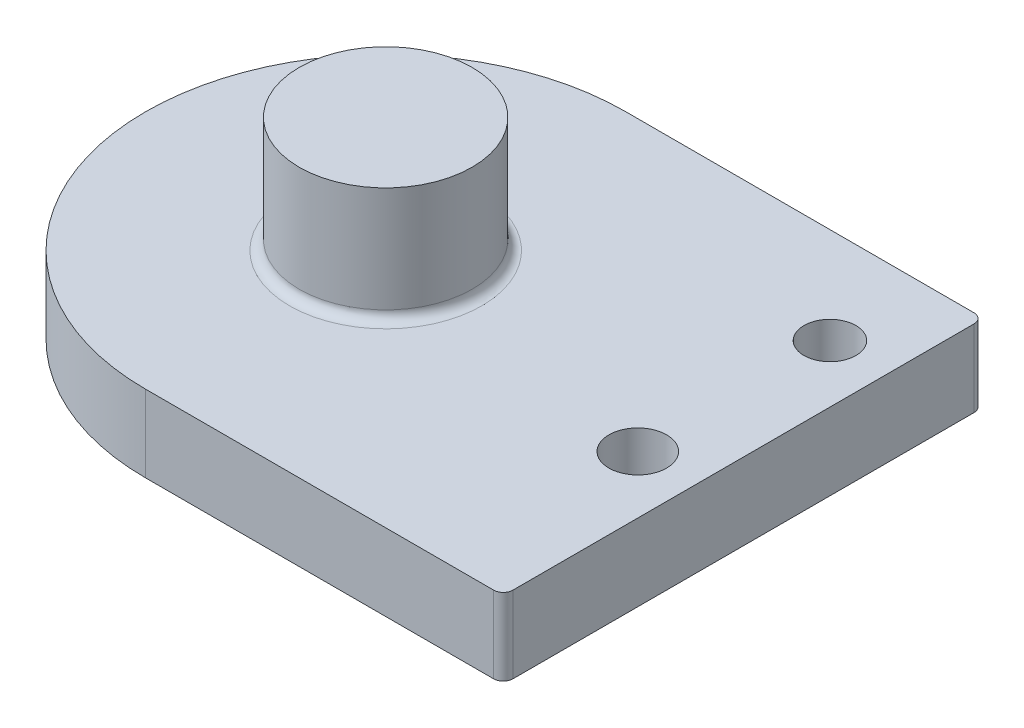
from build123d import *

# Parameters (mm, degrees)
EXTRUDE_1_DEPTH     = 2
SKETCH_2_R          = 2.25
EXTRUDE_2_DEPTH     = 3
SKETCH_3_R          = 0.676633681
SKETCH_3_R_2        = 0.750657672
CUT_EXTRUDE_1_DEPTH = 10
FILLET_1_R          = 0.25
FILLET_2_R          = 0.25


with BuildPart() as part:
    # 草图1 → 凸台-拉伸1 (new body)
    with BuildSketch(Plane(origin=(0, 0, 0), x_dir=(1, 0, 0), z_dir=(0, 1, 0))):
        with BuildLine():
            Line((5, 0), (14.310335592, 0))
            Line((14.310335592, 0), (14.310335592, 12.5))
            Line((14.310335592, 12.5), (5, 12.5))
            ThreePointArc((5, 12.5), (-1.25, 6.25), (5, 0))
        make_face()
    extrude(amount=EXTRUDE_1_DEPTH)

    # 草图2 → 凸台-拉伸2 (add)
    with BuildSketch(Plane(origin=(0, 2, 0), x_dir=(1, 0, 0), z_dir=(0, 1, 0))):
        with Locations(Location((5, 6.25, 0), (0, 0, 270))):
            Circle(SKETCH_2_R)
    extrude(amount=EXTRUDE_2_DEPTH)

    # 草图3 → 切除-拉伸1 (cut)
    with BuildSketch(Plane(origin=(0, 2, 0), x_dir=(1, 0, 0), z_dir=(0, 1, 0))):
        with Locations(Location((12.810335592, 10, 0), (0, 0, 270))):
            Circle(SKETCH_3_R)
        with Locations(Location((12.810335592, 5, 0), (0, 0, 270))):
            Circle(SKETCH_3_R_2)
    extrude(amount=-CUT_EXTRUDE_1_DEPTH, mode=Mode.SUBTRACT)

    # 圆角1
    fillet_1_edges = [part.edges().sort_by_distance(p)[0] for p in [
        (5, 2, -8.5),
    ]]
    fillet(fillet_1_edges, radius=FILLET_1_R)

    # 圆角2
    fillet_2_edges = [part.edges().sort_by_distance(p)[0] for p in [
        (14.310335592, 1, 0),
        (14.310335592, 1, -12.5),
    ]]
    fillet(fillet_2_edges, radius=FILLET_2_R)


solid = part.part
